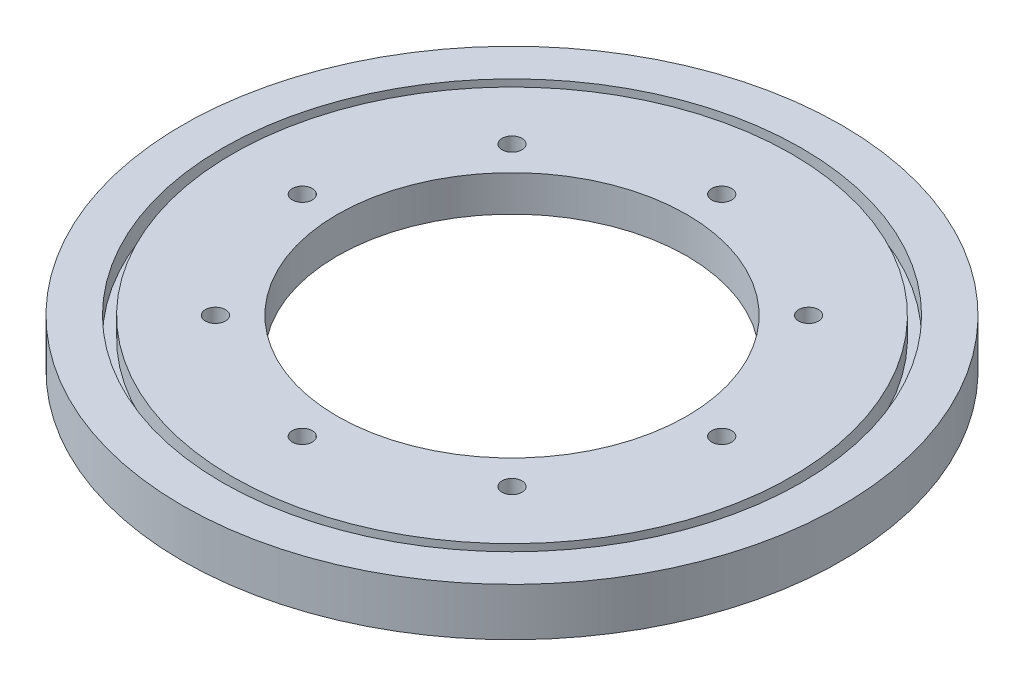
from build123d import *

# Parameters (mm, degrees)
SKETCH1_R          = 165
PLATE_DEPTH        = 24
SKETCH2_R          = 87.5
BEARING_HOLE_DEPTH = 235.576213628
SKETCH4_R          = 145
SKETCH4_R_2        = 140
CUT_EXTRUDE3_DEPTH = 10
SKETCH5_R          = 125
CUT_EXTRUDE4_DEPTH = 6
SKETCH6_R          = 5
CUT_EXTRUDE5_DEPTH = 235.038458378


with BuildPart() as part:
    # Sketch1 → plate (new body)
    with BuildSketch(Plane(origin=(0, 0, 0), x_dir=(1, 0, 0), z_dir=(0, 1, 0))):
        with Locations(Location((0, 0, 0), (0, 0, 270))):
            Circle(SKETCH1_R)
    extrude(amount=PLATE_DEPTH)

    # Sketch2 → bearing-hole (cut, through all)
    with BuildSketch(Plane(origin=(0, 24, 0), x_dir=(1, 0, 0), z_dir=(0, 1, 0))):
        with Locations(Location((0, 0, 0), (0, 0, 270))):
            Circle(SKETCH2_R)
    extrude(amount=-BEARING_HOLE_DEPTH, mode=Mode.SUBTRACT)

    # Sketch4 → Cut-Extrude3 (cut)
    with BuildSketch(Plane(origin=(0, 24, 0), x_dir=(1, 0, 0), z_dir=(0, 1, 0))):
        with Locations(Location((0, 0, 0), (0, 0, 270))):
            Circle(SKETCH4_R)
        with Locations(Location((0, 0, 0), (0, 0, 270))):
            Circle(SKETCH4_R_2, mode=Mode.SUBTRACT)
    extrude(amount=-CUT_EXTRUDE3_DEPTH, mode=Mode.SUBTRACT)

    # Sketch5 → Cut-Extrude4 (cut)
    with BuildSketch(Plane.XZ):
        with Locations(Location((0, 0, 0), (0, 0, 270))):
            Circle(SKETCH5_R)
    extrude(amount=-CUT_EXTRUDE4_DEPTH, mode=Mode.SUBTRACT)

    # Sketch6 → Cut-Extrude5 (cut, through all)
    with BuildSketch(Plane.XZ.offset(-6)):
        with Locations(Location((0, 105, 0), (0, 0, 270))):
            Circle(SKETCH6_R)
        with Locations(Location((74.246212025, 74.246212025, 0), (0, 0, 270))):
            Circle(SKETCH6_R)
        with Locations(Location((105, 0, 0), (0, 0, 270))):
            Circle(SKETCH6_R)
        with Locations(Location((74.246212025, -74.246212025, 0), (0, 0, 270))):
            Circle(SKETCH6_R)
        with Locations(Location((0, -105, 0), (0, 0, 270))):
            Circle(SKETCH6_R)
        with Locations(Location((-74.246212025, -74.246212025, 0), (0, 0, 270))):
            Circle(SKETCH6_R)
        with Locations(Location((-105, 0, 0), (0, 0, 270))):
            Circle(SKETCH6_R)
        with Locations(Location((-74.246212025, 74.246212025, 0), (0, 0, 270))):
            Circle(SKETCH6_R)
    extrude(amount=-CUT_EXTRUDE5_DEPTH, mode=Mode.SUBTRACT)


solid = part.part
